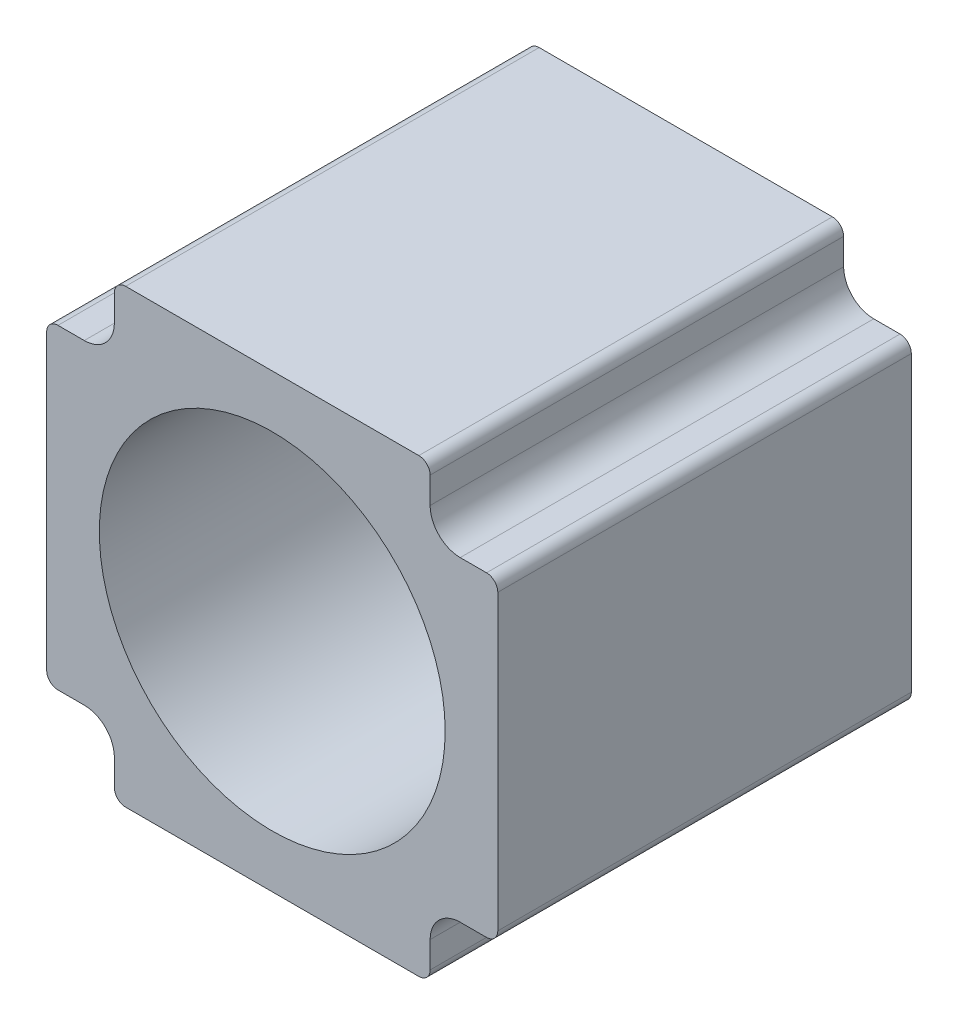
from build123d import *

# Parameters (mm, degrees)
BOSS_EXTRUDE1_DEPTH = 55
FILLET1_R           = 4
FILLET2_R           = 1.5
SKETCH2_R           = 23
CUT_EXTRUDE1_DEPTH  = 102.118742081
SCALE1_SCALE        = 2.3


with BuildPart() as part:
    # Sketch1 → Boss-Extrude1 (new body)
    with BuildSketch(Plane.XY):
        Polygon((9, 0), (51, 0), (51, 9), (60, 9), (60, 51), (51, 51), (51, 60), (9, 60), (9, 51), (0, 51), (0, 9), (9, 9), align=None)
    extrude(amount=BOSS_EXTRUDE1_DEPTH)

    # Fillet1
    fillet1_edges = [part.edges().sort_by_distance(p)[0] for p in [
        (9, 9, 27.5),
        (9, 51, 27.5),
        (51, 51, 27.5),
        (51, 9, 27.5),
    ]]
    fillet(fillet1_edges, radius=FILLET1_R)

    # Fillet2
    fillet2_edges = [part.edges().sort_by_distance(p)[0] for p in [
        (51, 0, 27.5),
        (9, 0, 27.5),
        (0, 9, 27.5),
        (0, 51, 27.5),
        (9, 60, 27.5),
        (51, 60, 27.5),
        (60, 51, 27.5),
        (60, 9, 27.5),
    ]]
    fillet(fillet2_edges, radius=FILLET2_R)

    # Sketch2 → Cut-Extrude1 (cut, through all)
    with BuildSketch(Plane.XY.offset(55)):
        with Locations((30, 30)):
            Circle(SKETCH2_R)
    extrude(amount=-CUT_EXTRUDE1_DEPTH, mode=Mode.SUBTRACT)


with BuildPart() as part_1:
    # Scale1: scaled about (30, 30, 27.5)
    add(part.part.scale(SCALE1_SCALE).moved(Location((-39, -39, -35.75))))


solid = part_1.part
